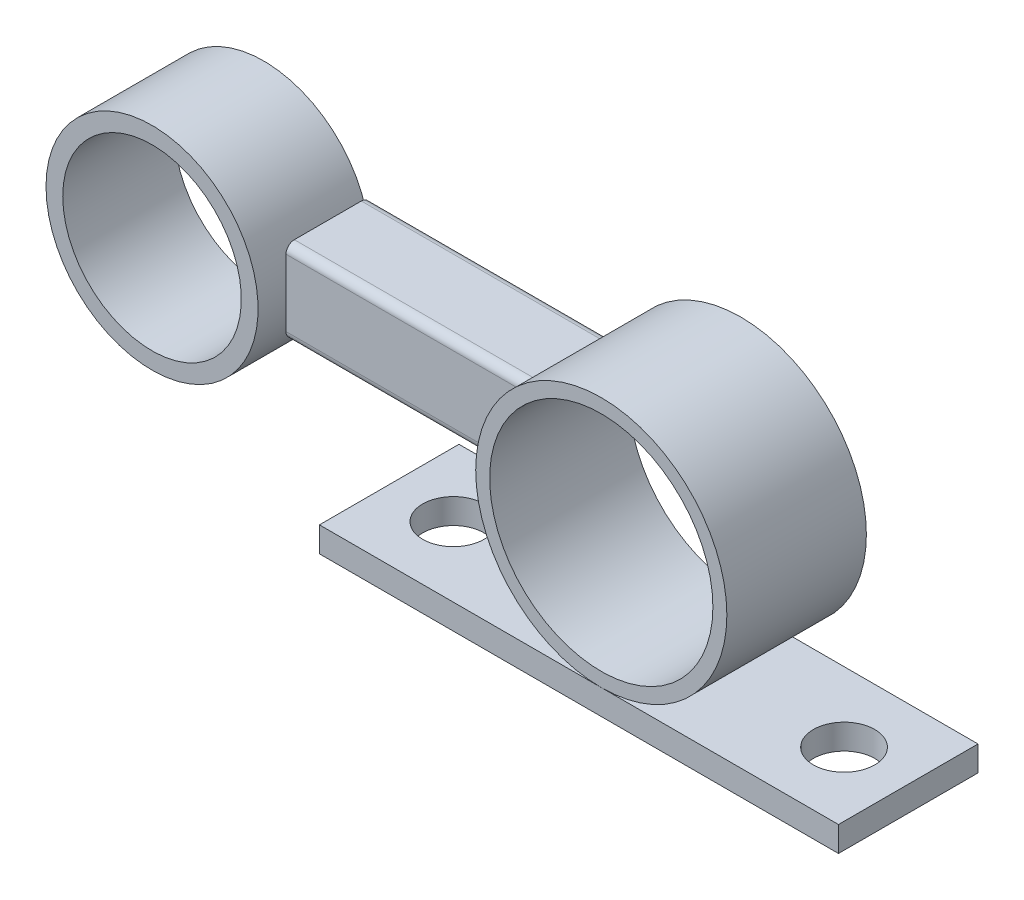
from build123d import *

# Parameters (mm, degrees)
SKETCH_1_W                        = 93
SKETCH_1_H                        = 25
SKETCH_1_R                        = 5.5
EXTRUDE_1_DEPTH                   = 4.5
SKETCH_2_R                        = 22.5
SKETCH_2_R_2                      = 20
EXTRUDE_2_DEPTH                   = 25
BXBXS_8639_82_15_X_15_X_1_1_DEPTH = 44
SKETCH_7_R                        = 19
SKETCH_7_R_2                      = 16
EXTRUDE_3_DEPTH                   = 20


with BuildPart() as part:
    # Эскиз1 → Бобышка-Вытянуть1 (new body)
    with BuildSketch(Plane(origin=(0, 0, 0), x_dir=(1, 0, 0), z_dir=(0, 1, 0))):
        Rectangle(SKETCH_1_W, SKETCH_1_H)
        with Locations(Location((35, 0, 0), (0, 0, 270))):
            Circle(SKETCH_1_R, mode=Mode.SUBTRACT)
        with Locations(Location((-35, 0, 0), (0, 0, 270))):
            Circle(SKETCH_1_R, mode=Mode.SUBTRACT)
    extrude(amount=EXTRUDE_1_DEPTH)


with BuildPart() as body_2:
    # Эскиз2 → Бобышка-Вытянуть2 (new body)
    with BuildSketch(Plane.XY.offset(12.5)):
        with Locations((4, 27)):
            Circle(SKETCH_2_R)
        with Locations((4, 27)):
            Circle(SKETCH_2_R_2, mode=Mode.SUBTRACT)
    extrude(amount=-EXTRUDE_2_DEPTH)


with BuildPart() as body_3:
    # Sketch1 → Труба bxbxs гост8639-82 15 X 15 X 1(1) (new body)
    with BuildSketch(Plane(origin=(-62.494443758, 27.5, -5), x_dir=(0, -1, 0), z_dir=(1, 0, 0))):
        with BuildLine():
            Line((-6, -7.5), (6, -7.5))
            ThreePointArc((6, -7.5), (7.060660172, -7.060660172), (7.5, -6))
            Line((7.5, -6), (7.5, 6))
            ThreePointArc((7.5, 6), (7.060660172, 7.060660172), (6, 7.5))
            Line((6, 7.5), (-6, 7.5))
            ThreePointArc((-6, 7.5), (-7.060660172, 7.060660172), (-7.5, 6))
            Line((-7.5, 6), (-7.5, -6))
            ThreePointArc((-7.5, -6), (-7.060660172, -7.060660172), (-6, -7.5))
        make_face()
        with BuildLine():
            Line((-6, -6.5), (6, -6.5))
            ThreePointArc((6, -6.5), (6.353553391, -6.353553391), (6.5, -6))
            Line((6.5, -6), (6.5, 6))
            ThreePointArc((6.5, 6), (6.353553391, 6.353553391), (6, 6.5))
            Line((6, 6.5), (-6, 6.5))
            ThreePointArc((-6, 6.5), (-6.353553391, 6.353553391), (-6.5, 6))
            Line((-6.5, 6), (-6.5, -6))
            ThreePointArc((-6.5, -6), (-6.353553391, -6.353553391), (-6, -6.5))
        make_face(mode=Mode.SUBTRACT)
    extrude(amount=BXBXS_8639_82_15_X_15_X_1_1_DEPTH)


with BuildPart() as body_4:
    # Эскиз7 → Бобышка-Вытянуть3 (new body)
    with BuildSketch(Plane(origin=(0, 0, -12.5), x_dir=(-1, 0, 0), z_dir=(0, 0, -1))):
        with Locations((81.494443758, 27.5)):
            Circle(SKETCH_7_R)
        with Locations((81.494443758, 27.5)):
            Circle(SKETCH_7_R_2, mode=Mode.SUBTRACT)
    extrude(amount=-EXTRUDE_3_DEPTH)


solid = Compound([part.part, body_2.part, body_3.part, body_4.part])
